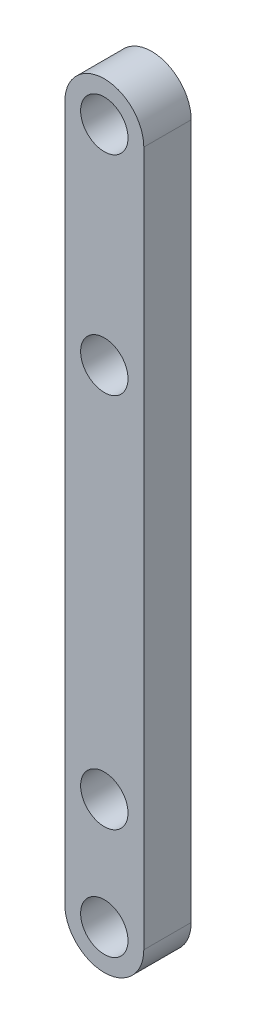
from build123d import *

# Parameters (mm, degrees)
SKETCH1_R           = 15
BOSS_EXTRUDE1_DEPTH = 30


with BuildPart() as part:
    # Sketch1 → Boss-Extrude1 (new body)
    with BuildSketch(Plane.XY):
        with BuildLine():
            Line((-25, 0), (-25, 440))
            ThreePointArc((-25, 440), (0, 465), (25, 440))
            Line((25, 440), (25, 0))
            ThreePointArc((25, 0), (0, -25), (-25, 0))
        make_face()
        with Locations((0, 440)):
            Circle(SKETCH1_R, mode=Mode.SUBTRACT)
        with Locations((0, 308)):
            Circle(SKETCH1_R, mode=Mode.SUBTRACT)
        with Locations((0, 70)):
            Circle(SKETCH1_R, mode=Mode.SUBTRACT)
        Circle(SKETCH1_R, mode=Mode.SUBTRACT)
    extrude(amount=BOSS_EXTRUDE1_DEPTH)


solid = part.part
